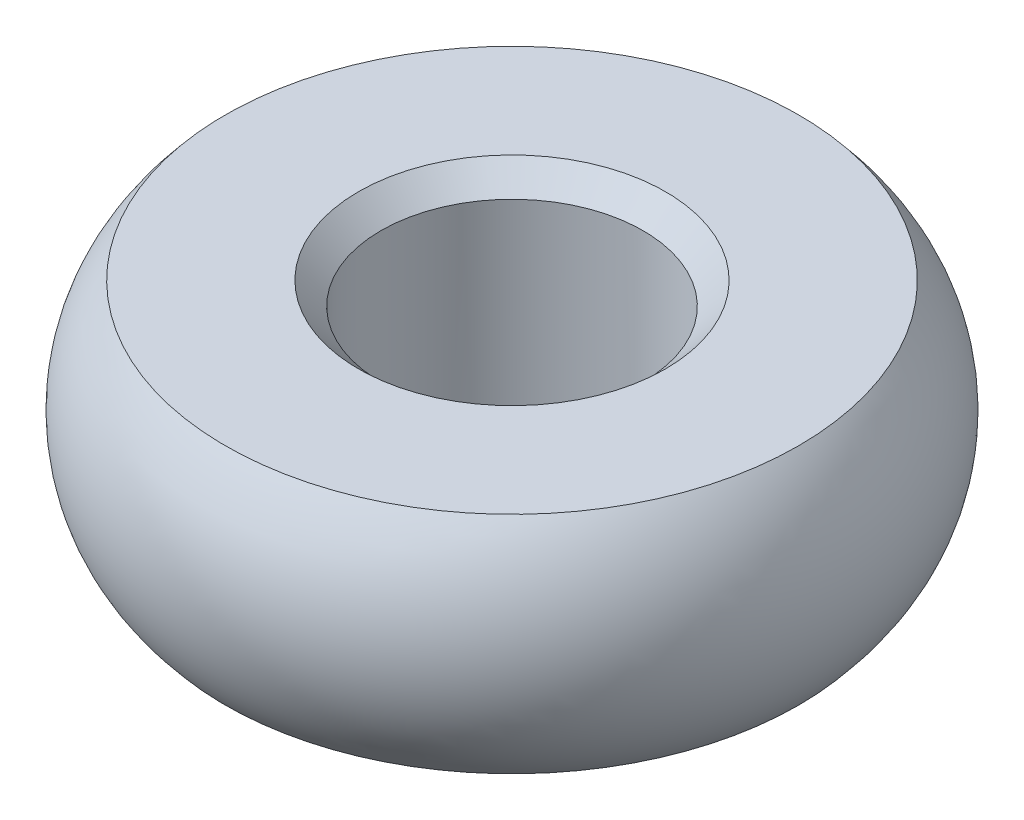
from build123d import *

# Parameters (mm, degrees)
CHAMFER1_SIZE = 3


with BuildPart() as part:
    # Sketch1 → Revolve1 (revolve)
    with BuildSketch(Plane.XY):
        with BuildLine():
            Line((17.5, 15), (17.5, -15))
            Line((17.5, -15), (38.270509831, -15))
            ThreePointArc((38.270509831, -15), (44, 0), (38.270509831, 15))
            Line((38.270509831, 15), (17.5, 15))
        make_face()
    revolve(axis=Axis((0, -562.822725834, 0), (0, 1, 0)))

    # Chamfer1
    chamfer1_edges = [part.edges().sort_by_distance(p)[0] for p in [
        (-17.5, 15, 0),
        (-17.5, -15, 0),
    ]]
    chamfer(chamfer1_edges, length=CHAMFER1_SIZE)


solid = part.part
